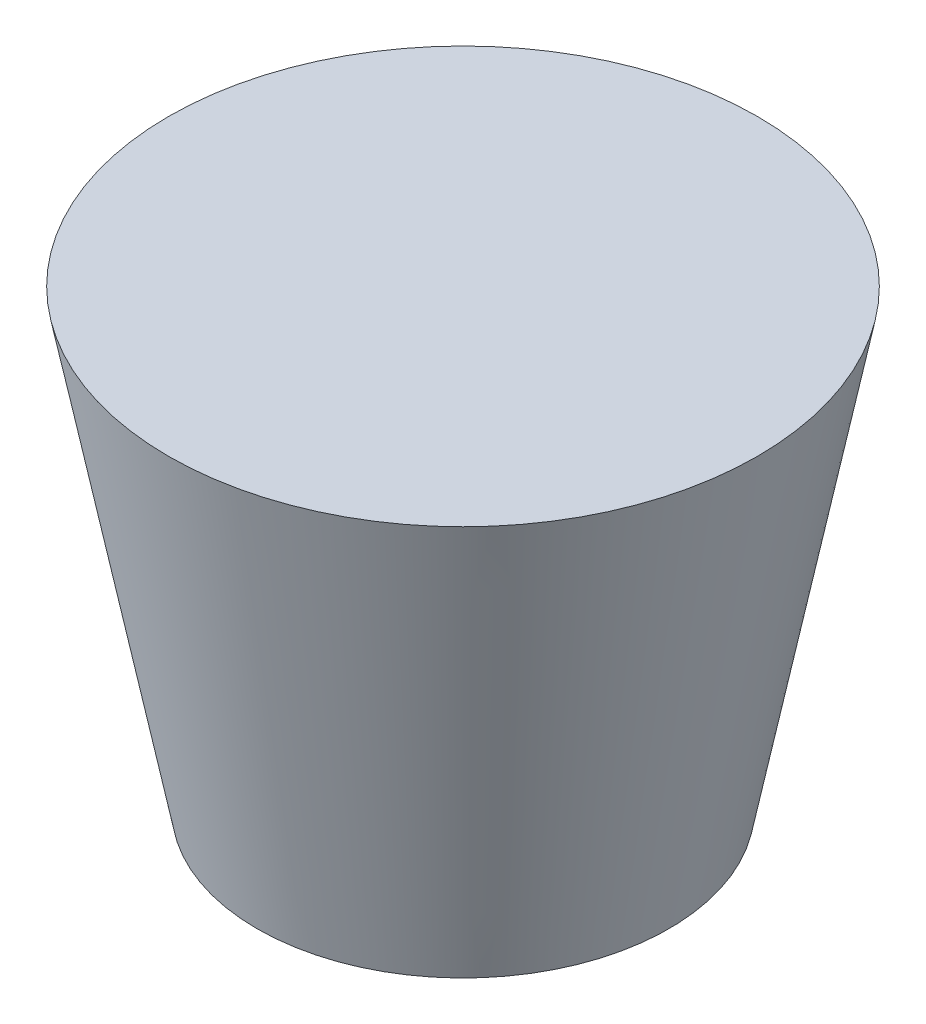
from build123d import *


with BuildPart() as part:
    # Sketch1 → Revolve-Thin1 (revolve)
    with BuildSketch(Plane.XY, mode=Mode.PRIVATE) as revolve_thin1_sk:
        Polygon((0, 75.122015915), (143.5066313, 75.122015915), (100.387267905, -145.864721485), (0, -145.864721485), (0, -143.324721485), (98.294977154, -143.324721485), (140.423121037, 72.582015915), (0, 72.582015915), align=None)
    revolve(revolve_thin1_sk.sketch.rotate(Axis((0, 93.986737401, 0), (0, -1, 0)), 90), axis=Axis((0, 93.986737401, 0), (0, -1, 0)))


solid = part.part
